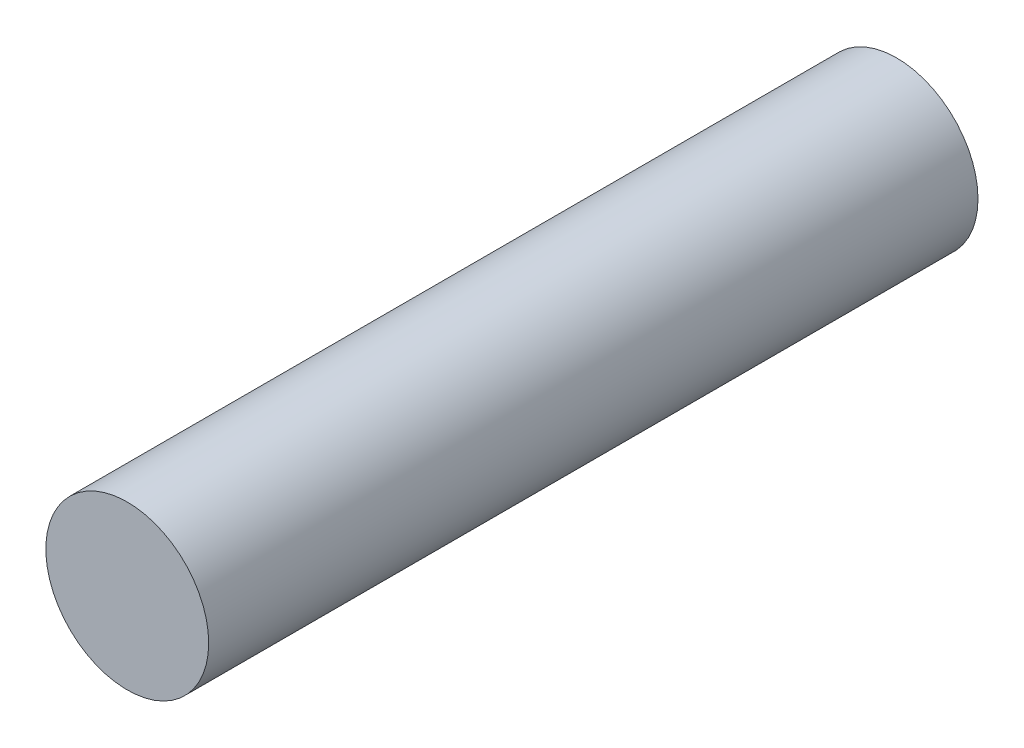
from build123d import *

# Parameters (mm, degrees)
BOSS_EXTRUDE1_DEPTH      = 187
BOSS_EXTRUDE1_DEPTH_BACK = 293
SKETCH1_R                = 50.8


with BuildPart() as part:
    # Sketch1 → Boss-Extrude1 (new, two sides: drawn at the far end of the back side and taken through both)
    with BuildSketch(Plane.XY.offset(-BOSS_EXTRUDE1_DEPTH_BACK)):
        Circle(SKETCH1_R)
    extrude(amount=BOSS_EXTRUDE1_DEPTH + BOSS_EXTRUDE1_DEPTH_BACK)


solid = part.part
